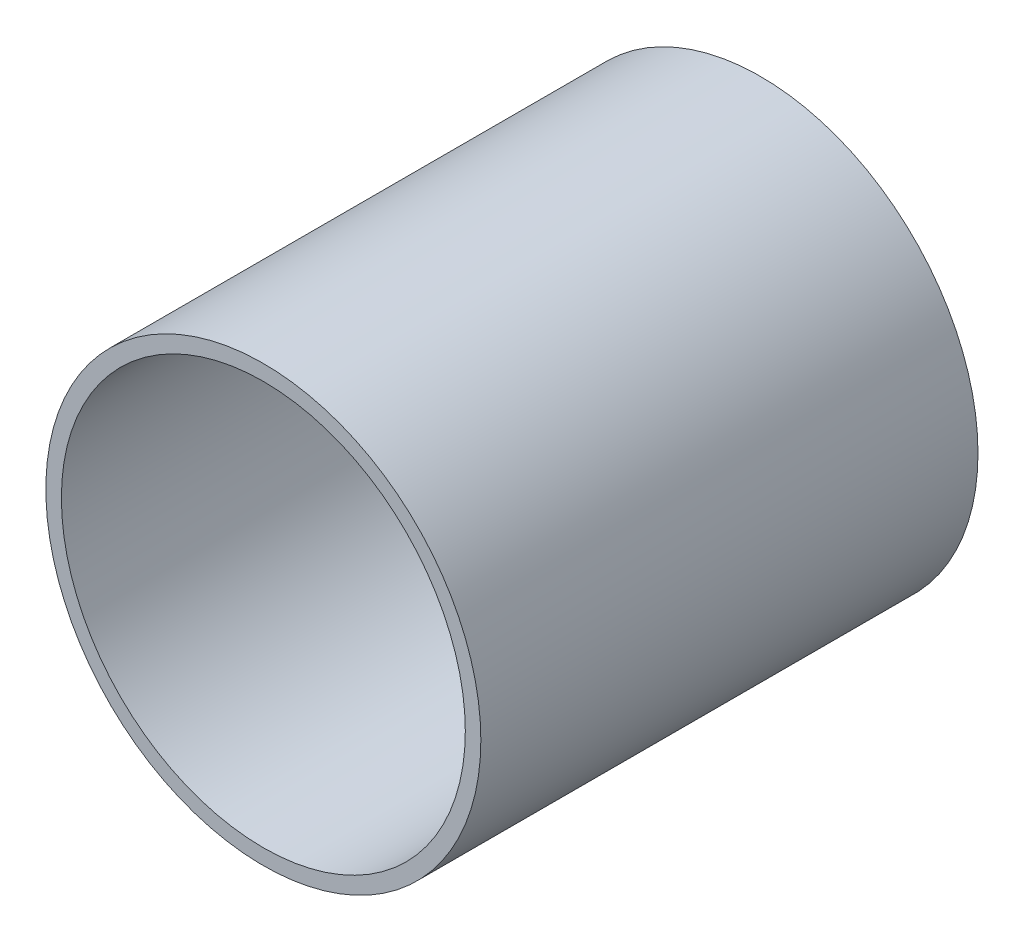
from build123d import *

# Parameters (mm, degrees)
SKETCH1_R           = 88.9
SKETCH1_R_2         = 82.55
BOSS_EXTRUDE1_DEPTH = 203.2


with BuildPart() as part:
    # Sketch1 → Boss-Extrude1 (new body)
    with BuildSketch(Plane.XY):
        Circle(SKETCH1_R)
        Circle(SKETCH1_R_2, mode=Mode.SUBTRACT)
    extrude(amount=BOSS_EXTRUDE1_DEPTH)


solid = part.part
